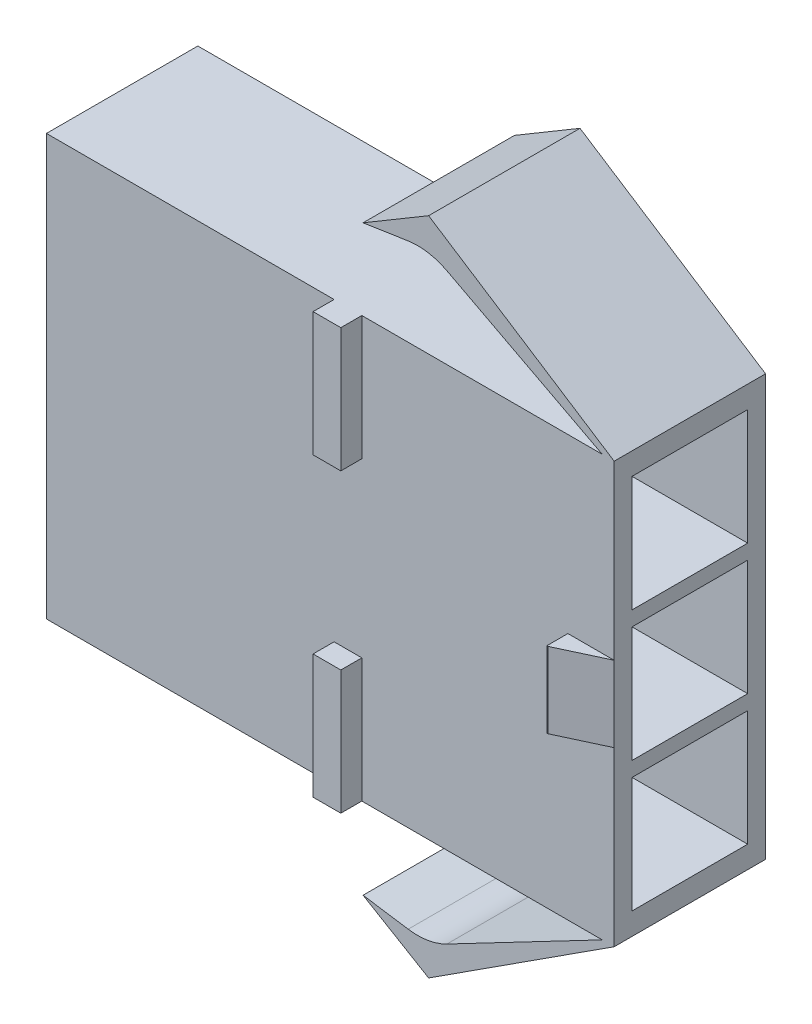
from build123d import *

# Parameters (mm, degrees)
SKETCH_1_W          = 27
SKETCH_1_H          = 20
EXTRUDE_1_DEPTH     = 7.2
SKETCH_2_W          = 5.5
SKETCH_2_H          = 5.5
CUT_EXTRUDE_1_DEPTH = 10.2
SKETCH_3_R          = 2.75
CUT_EXTRUDE_2_DEPTH = 18
SKETCH_4_W          = 1.32
SKETCH_4_H          = 5.9
SKETCH_4_W_2        = 2.2
SKETCH_4_H_2        = 3.6
EXTRUDE_2_DEPTH     = 1
CHAMFER_1_SIZE      = 1
CHAMFER_1_SIZE2     = 2.144506921
EXTRUDE_4_DEPTH     = 1
EXTRUDE_5_DEPTH     = 7.2
FILLET_1_R          = 3
FILLET_2_R          = 3


with BuildPart() as part:
    # 草图1 → 凸台-拉伸1 (new body)
    with BuildSketch(Plane.XY):
        Rectangle(SKETCH_1_W, SKETCH_1_H)
    extrude(amount=EXTRUDE_1_DEPTH)

    # 草图2 → 切除-拉伸1 (cut)
    with BuildSketch(Plane(origin=(13.5, 0, 0), x_dir=(0, 0, -1), z_dir=(1, 0, 0))):
        with Locations((-3.6, -6.2)):
            Rectangle(SKETCH_2_W, SKETCH_2_H)
        with Locations((-3.6, 0)):
            Rectangle(SKETCH_2_W, SKETCH_2_H)
        with Locations((-3.6, 6.2)):
            Rectangle(SKETCH_2_W, SKETCH_2_H)
    extrude(amount=-CUT_EXTRUDE_1_DEPTH, mode=Mode.SUBTRACT)

    # 草图3 → 切除-拉伸2 (cut)
    with BuildSketch(Plane.ZY.offset(13.5)):
        with Locations((3.6, 0)):
            Circle(SKETCH_3_R)
        with Locations((3.920071901, 6.2)):
            Circle(SKETCH_3_R)
        with Locations((3.6, -6.2)):
            Circle(SKETCH_3_R)
    extrude(amount=-CUT_EXTRUDE_2_DEPTH, mode=Mode.SUBTRACT)

    # 草图4 → 凸台-拉伸2 (add)
    with BuildSketch(Plane.XY.offset(7.2)):
        with Locations((0.84, 7.05)):
            Rectangle(SKETCH_4_W, SKETCH_4_H)
        with Locations((0.84, -7.05)):
            Rectangle(SKETCH_4_W, SKETCH_4_H)
        with Locations((12.4, 0)):
            Rectangle(SKETCH_4_W_2, SKETCH_4_H_2)
    extrude(amount=EXTRUDE_2_DEPTH)

    # 倒角1
    chamfer_1_edges = [part.edges().sort_by_distance(p)[0] for p in [
        (13.5, 0, 8.2),
    ]]
    chamfer_1_side = [part.faces().sort_by_distance(p)[0] for p in [
        (13.5, -9.78384265, 3.6),
    ]]
    chamfer(chamfer_1_edges, length=CHAMFER_1_SIZE, length2=CHAMFER_1_SIZE2, reference=chamfer_1_side[0])

    # 草图6 → 凸台-拉伸4 (add)
    with BuildSketch(Plane(origin=(0, 0, 0), x_dir=(-1, 0, 0), z_dir=(0, 0, -1))):
        Polygon((-8.1, -1.6), (-8.1, 1.6), (-1.9, 1.6), (-1.9, 5.9), (-0.6, 5.9), (-0.6, -5.9), (-1.9, -5.9), (-1.9, -1.6), align=None)
    extrude(amount=EXTRUDE_4_DEPTH)

    # 草图7 → 凸台-拉伸5 (add)
    with BuildSketch(Plane(origin=(0, 0, 0), x_dir=(-1, 0, 0), z_dir=(0, 0, -1))):
        Polygon((-13.5, 10), (-4.675788996, 15.698556705), (-1.558596332, 13.847723561), (-4.675788996, 14.319689506), (-12.931993779, 10), align=None)
        Polygon((-12.931993779, -10), (-13.5, -10), (-4.675788996, -15.698556705), (-1.558596332, -13.847723561), (-4.675788996, -14.319689506), align=None)
    extrude(amount=-EXTRUDE_5_DEPTH)

    # 圆角1
    fillet_1_edges = [part.edges().sort_by_distance(p)[0] for p in [
        (4.675788996, 14.319689506, 3.6),
    ]]
    fillet(fillet_1_edges, radius=FILLET_1_R)

    # 圆角2
    fillet_2_edges = [part.edges().sort_by_distance(p)[0] for p in [
        (4.675788996, -14.319689506, 3.6),
    ]]
    fillet(fillet_2_edges, radius=FILLET_2_R)


solid = part.part
